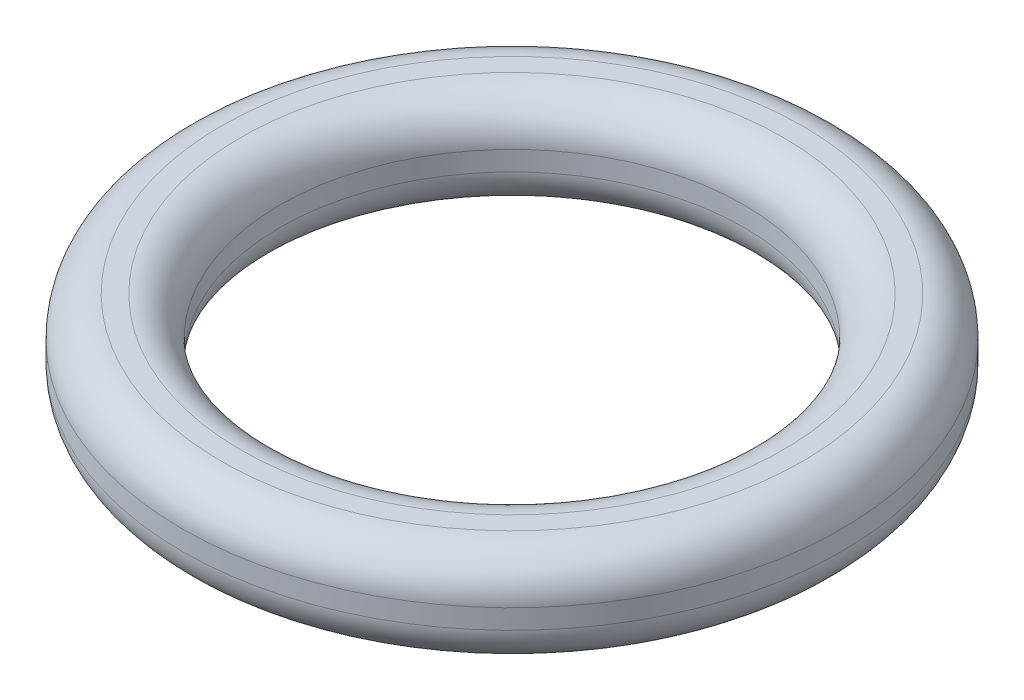
from build123d import *


with BuildPart() as part:
    # Esquisse1 → Révolution1 (revolve)
    with BuildSketch(Plane.XY, mode=Mode.PRIVATE) as r_volution1_sk:
        with BuildLine():
            Line((-5.95, 2), (-5.55, 2))
            ThreePointArc((-5.55, 2), (-4.984314575, 1.765685425), (-4.75, 1.2))
            Line((-4.75, 1.2), (-4.75, 0.8))
            ThreePointArc((-4.75, 0.8), (-4.984314575, 0.234314575), (-5.55, 0))
            Line((-5.55, 0), (-5.95, 0))
            ThreePointArc((-5.95, 0), (-6.515685425, 0.234314575), (-6.75, 0.8))
            Line((-6.75, 0.8), (-6.75, 1.2))
            ThreePointArc((-6.75, 1.2), (-6.515685425, 1.765685425), (-5.95, 2))
        make_face()
    revolve(r_volution1_sk.sketch.rotate(Axis((0, 0, 0), (0, 1, 0)), 270), axis=Axis((0, 0, 0), (0, 1, 0)))


solid = part.part
